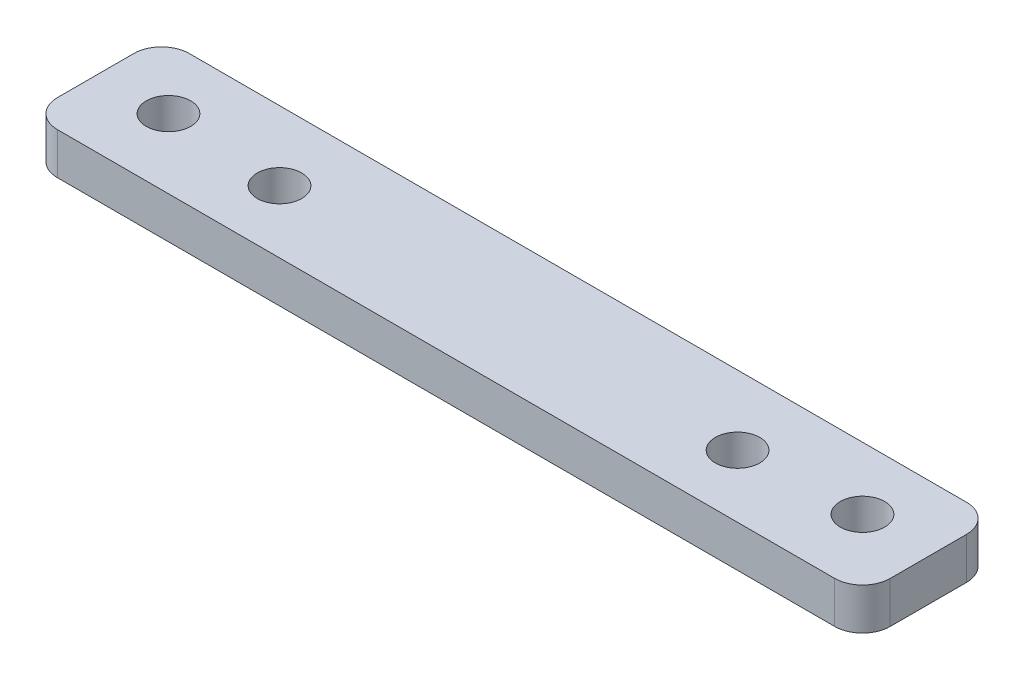
from build123d import *

# Parameters (mm, degrees)
SKETCH_1_W          = 60
SKETCH_1_H          = 9.5
EXTRUDE_1_DEPTH     = 3
SKETCH_2_R          = 1.6
CUT_EXTRUDE_1_DEPTH = 3
FILLET_1_R          = 2


with BuildPart() as part:
    # 草图1 → 凸台-拉伸1 (new body)
    with BuildSketch(Plane(origin=(0, 0, 0), x_dir=(1, 0, 0), z_dir=(0, 1, 0))):
        Rectangle(SKETCH_1_W, SKETCH_1_H)
    extrude(amount=EXTRUDE_1_DEPTH)

    # 草图2 → 切除-拉伸1 (cut)
    with BuildSketch(Plane(origin=(0, 3, 0), x_dir=(1, 0, 0), z_dir=(0, 1, 0))):
        with Locations(Location((-16.5, -0.25, 0), (0, 0, 270))):
            Circle(SKETCH_2_R)
        with Locations(Location((-25, 0.25, 0), (0, 0, 270))):
            Circle(SKETCH_2_R)
        with Locations(Location((25, 0.25, 0), (0, 0, 90))):
            Circle(SKETCH_2_R)
        with Locations(Location((16.5, -0.25, 0), (0, 0, 90))):
            Circle(SKETCH_2_R)
    extrude(amount=-CUT_EXTRUDE_1_DEPTH, mode=Mode.SUBTRACT)

    # 圆角1
    fillet_1_edges = [part.edges().sort_by_distance(p)[0] for p in [
        (-30, 1.5, -4.75),
        (30, 1.5, -4.75),
        (30, 1.5, 4.75),
        (-30, 1.5, 4.75),
    ]]
    fillet(fillet_1_edges, radius=FILLET_1_R)


solid = part.part
